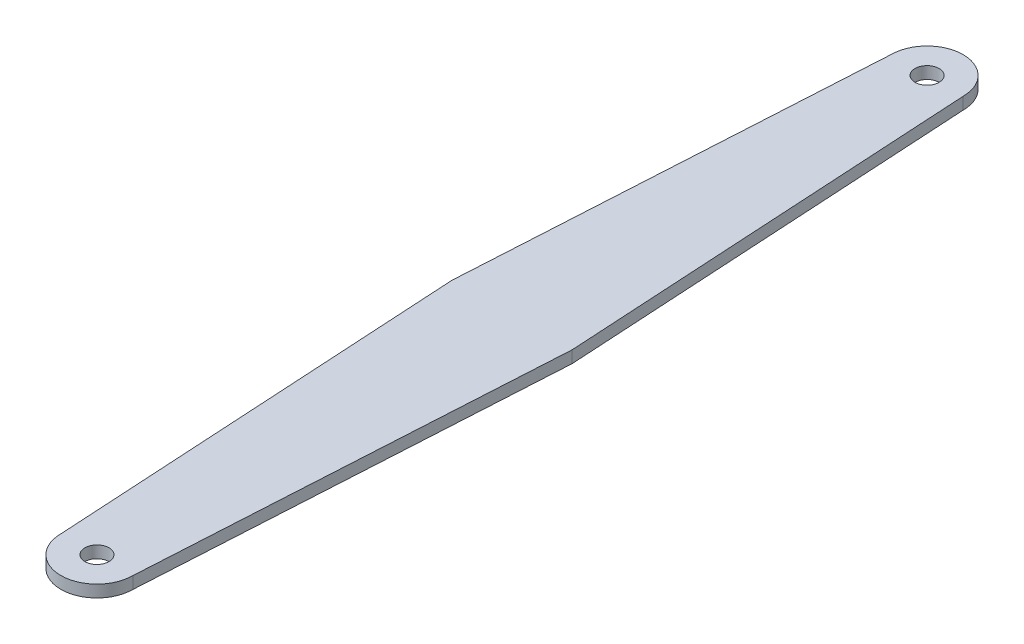
from build123d import *

# Parameters (mm, degrees)
BOSS_EXTRUDE1_DEPTH = 10
SKETCH2_R           = 10
CUT_EXTRUDE1_DEPTH  = 10


with BuildPart() as part:
    # Sketch1 → Boss-Extrude1 (new body)
    with BuildSketch(Plane(origin=(0, 0, 0), x_dir=(1, 0, 0), z_dir=(0, 1, 0))):
        with BuildLine():
            Line((20, 345), (0, 0))
            Line((0, 0), (20, -345))
            ThreePointArc((20, -345), (50, -375), (80, -345))
            Line((80, -345), (100, 0))
            Line((100, 0), (80, 345))
            ThreePointArc((80, 345), (50, 375), (20, 345))
        make_face()
    extrude(amount=BOSS_EXTRUDE1_DEPTH)

    # Sketch2 → Cut-Extrude1 (cut)
    with BuildSketch(Plane(origin=(0, 10, 0), x_dir=(1, 0, 0), z_dir=(0, 1, 0))):
        with Locations(Location((50, -345, 0), (0, 0, 270))):
            Circle(SKETCH2_R)
        with Locations(Location((50, 345, 0), (0, 0, 90))):
            Circle(SKETCH2_R)
    extrude(amount=-CUT_EXTRUDE1_DEPTH, mode=Mode.SUBTRACT)


solid = part.part
